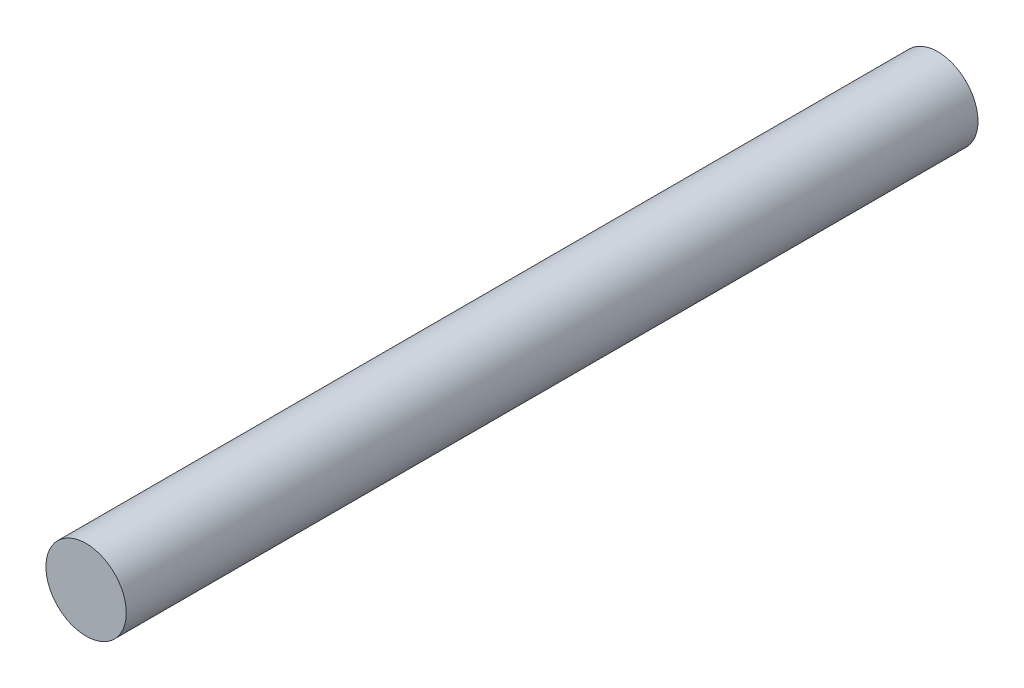
from build123d import *

# Parameters (mm, degrees)
SKETCH1_R           = 2.5
BOSS_EXTRUDE1_DEPTH = 26.5


with BuildPart() as part:
    # Sketch1 → Boss-Extrude1 (new, symmetric)
    with BuildSketch(Plane.XY):
        Circle(SKETCH1_R)
    extrude(amount=BOSS_EXTRUDE1_DEPTH, both=True)


solid = part.part
